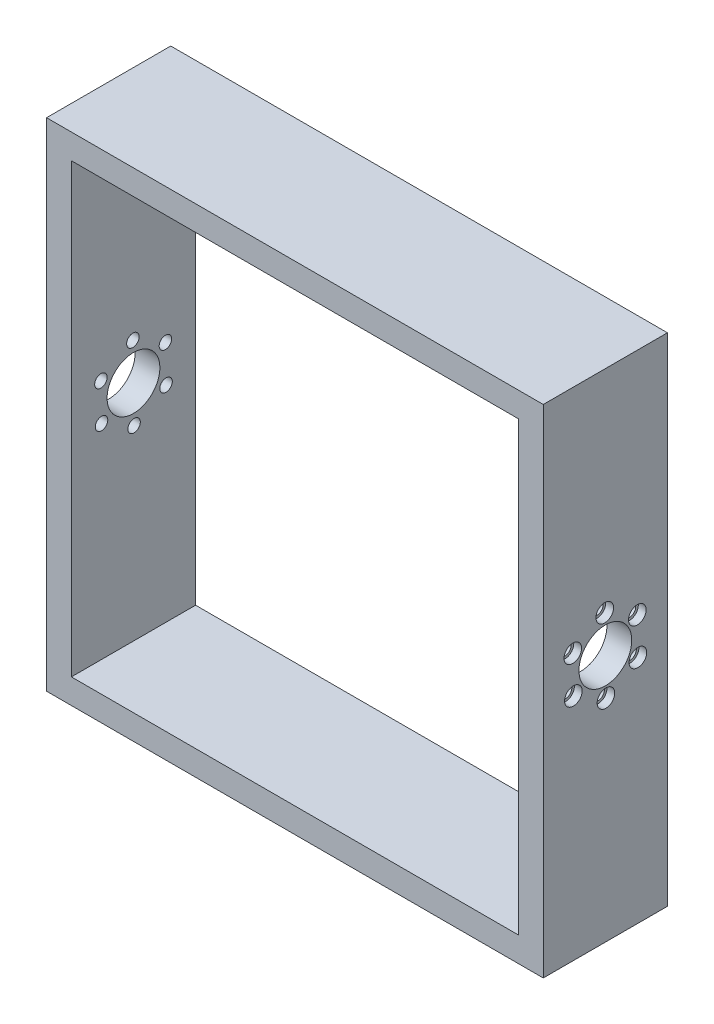
from build123d import *

# Parameters (mm, degrees)
BOSS_EXTRUDE1_DEPTH            = 76.2
BOSS_EXTRUDE1_DEPTH_BACK       = 76.2
SKETCH3_W                      = 127
SKETCH3_H                      = 127
SKETCH3_W_2                    = 114.3
SKETCH3_H_2                    = 114.3
SKETCH6_W                      = 127
SKETCH6_H                      = 120.65
CUT_EXTRUDE1_DEPTH             = 162.144934764
M12_CLEARANCE_HOLE1_D          = 13.5
CBORE_FOR_M3_SHCS1_D           = 3.2
CBORE_FOR_M3_SHCS1_DEPTH       = 6.35
CBORE_FOR_M3_SHCS1_CBORE_D     = 4.5
CBORE_FOR_M3_SHCS1_CBORE_DEPTH = 2
CBORE_FOR_M3_SHCS2_D           = 3.2
CBORE_FOR_M3_SHCS2_CBORE_D     = 4.5
CBORE_FOR_M3_SHCS2_CBORE_DEPTH = 2


with BuildPart() as part:
    # Sketch3 → Boss-Extrude1 (new, two sides: drawn at the far end of the back side and taken through both)
    with BuildSketch(Plane.XY.offset(-BOSS_EXTRUDE1_DEPTH_BACK)):
        Rectangle(SKETCH3_W, SKETCH3_H)
        Rectangle(SKETCH3_W_2, SKETCH3_H_2, mode=Mode.SUBTRACT)
    extrude(amount=BOSS_EXTRUDE1_DEPTH + BOSS_EXTRUDE1_DEPTH_BACK)

    # Sketch6 → Cut-Extrude1 (cut, through all)
    with BuildSketch(Plane(origin=(0, 63.5, 0), x_dir=(1, 0, 0), z_dir=(0, 1, 0))):
        with Locations((0, 15.875)):
            Rectangle(SKETCH6_W, SKETCH6_H)
    extrude(amount=-CUT_EXTRUDE1_DEPTH, mode=Mode.SUBTRACT)

    # M12 Clearance Hole1 (through all)
    with Locations(Plane(origin=(63.5, 0, 0), x_dir=(0, 0, -1), z_dir=(1, 0, 0))):
        with Locations((-60.325, 0)):
            Hole(M12_CLEARANCE_HOLE1_D / 2)

    # CBORE for M3 SHCS1
    with Locations(Plane(origin=(63.5, 0, 0), x_dir=(0, 0, -1), z_dir=(1, 0, 0))):
        with Locations((-68.496426866, -4.894221897), (-68.649233927, 4.629552303), (-60.477807061, 9.523774199), (-52.153573134, 4.894221897), (-52.000766073, -4.629552303), (-60.172192939, -9.523774199)):
            CounterBoreHole(CBORE_FOR_M3_SHCS1_D / 2, CBORE_FOR_M3_SHCS1_CBORE_D / 2, CBORE_FOR_M3_SHCS1_CBORE_DEPTH, depth=CBORE_FOR_M3_SHCS1_DEPTH)

    # CBORE for M3 SHCS2 (through all)
    with Locations(Plane.ZY.offset(63.5)):
        with Locations((68.649233927, 4.629552303), (60.477807061, 9.523774199), (68.496426866, -4.894221897), (52.153573134, 4.894221897), (52.000766073, -4.629552303), (60.172192939, -9.523774199)):
            CounterBoreHole(CBORE_FOR_M3_SHCS2_D / 2, CBORE_FOR_M3_SHCS2_CBORE_D / 2, CBORE_FOR_M3_SHCS2_CBORE_DEPTH)


solid = part.part
